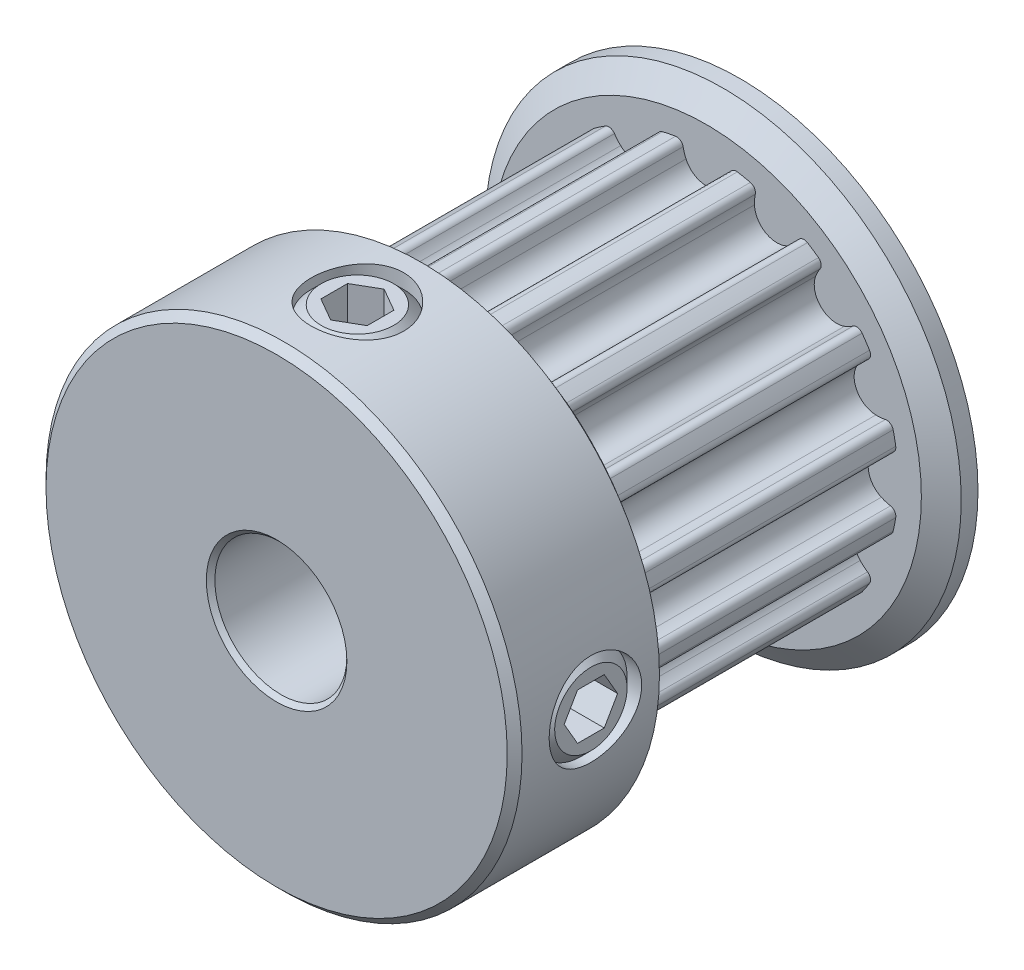
from build123d import *

# Parameters (mm, degrees)
CUT_EXTRUDE1_START = 2.655
CUT_EXTRUDE1_DEPTH = 10.16
CIRPATTERN1_COUNT  = 16
SKETCH4_R          = 1.7526
CUT_EXTRUDE2_DEPTH = 16.477114557
CUT_EXTRUDE3_DEPTH = 1.31445
CIRPATTERN3_COUNT  = 2
CIRPATTERN3_ANGLE  = 90
CHAMFER1_SIZE      = 0.28075
SKETCH7_R          = 2.5
CUT_EXTRUDE4_DEPTH = 22.692002065


with BuildPart() as part:
    # Sketch2 → Revolve1 (revolve)
    with BuildSketch(Plane(origin=(0, 0, 0), x_dir=(0, 0, -1), z_dir=(1, 0, 0)), mode=Mode.PRIVATE) as revolve1_sk:
        Polygon((-8.775, 2.38125), (8.775, 2.38125), (8.775, 9.015), (8.14, 9.015), (7.505, 8.13975), (7.505, 7.2645), (-2.655, 7.2645), (-2.655, 8.13975), (-3.29, 9.015), (-8.775, 9.015), align=None)
    revolve(revolve1_sk.sketch.rotate(Axis((0, 0, 8.775), (0, 0, -1)), 90), axis=Axis((0, 0, 8.775), (0, 0, -1)))

    # Sketch3 → Cut-Extrude1 (cut)
    with BuildSketch(Plane.XY.offset(CUT_EXTRUDE1_START)):
        with BuildLine():
            Line((3.757926927, 9.015), (-3.757926927, 9.015))
            Line((-3.757926927, 9.015), (-2.795101196, 6.705249403))
            ThreePointArc((-2.795101196, 6.705249403), (-1.995846132, 6.984952288), (-1.169472895, 7.169748489))
            ThreePointArc((-1.169472895, 7.169748489), (-0.985767742, 7.127751824), (-0.883573242, 6.969424355))
            ThreePointArc((-0.883573242, 6.969424355), (-0.839120956, 6.792881518), (-0.773880597, 6.622919538))
            ThreePointArc((-0.773880597, 6.622919538), (0, 6.1245), (0.773880597, 6.622919538))
            ThreePointArc((0.773880597, 6.622919538), (0.839120956, 6.792881518), (0.883573242, 6.969424355))
            ThreePointArc((0.883573242, 6.969424355), (0.985767742, 7.127751824), (1.169472895, 7.169748489))
            ThreePointArc((1.169472895, 7.169748489), (1.995846132, 6.984952288), (2.795101196, 6.705249403))
            Line((2.795101196, 6.705249403), (3.757926927, 9.015))
        make_face()
    cut_extrude1 = extrude(amount=-CUT_EXTRUDE1_DEPTH, mode=Mode.SUBTRACT)

    # CirPattern1: Cut-Extrude1 ×16 about axis
    cirpattern1_axis = Axis((0, 0, 0), (0, 0, 1))
    for i in range(1, CIRPATTERN1_COUNT):
        add(cut_extrude1.rotate(cirpattern1_axis, i * 360 / CIRPATTERN1_COUNT), mode=Mode.SUBTRACT)

    # Sketch4 → Cut-Extrude2 (cut, through all)
    with BuildSketch(Plane(origin=(0, 0, 0), x_dir=(0, -1, 0), z_dir=(1, 0, 0))):
        with Locations(Location((0, -5.715, 0), (0, 0, 270))):
            Circle(SKETCH4_R)
    cut_extrude2 = extrude(amount=CUT_EXTRUDE2_DEPTH, mode=Mode.SUBTRACT)

    # Sketch5 → Revolve2 (revolve)
    with BuildSketch(Plane.XY.offset(5.715), mode=Mode.PRIVATE) as revolve2_sk:
        Polygon((2.38125, -1.3716), (2.38125, 0), (8.842998261, 0), (8.842998261, -1.3716), (8.461998261, -1.7526), (2.76225, -1.7526), align=None)
    revolve2 = revolve(revolve2_sk.sketch.rotate(Axis((2.38125, 0, 5.715), (1, 0, 0)), 270), axis=Axis((2.38125, 0, 5.715), (1, 0, 0)))

    # Sketch6 → Cut-Extrude3 (cut)
    with BuildSketch(Plane(origin=(8.842998261, 5.384140679, 0), x_dir=(0, -1, 0), z_dir=(-1, 0, 0))):
        Polygon((5.384140679, 6.726864082), (4.507840679, 6.220932041), (4.507840679, 5.209067959), (5.384140679, 4.703135918), (6.260440679, 5.209067959), (6.260440679, 6.220932041), align=None)
    cut_extrude3 = extrude(amount=CUT_EXTRUDE3_DEPTH, mode=Mode.SUBTRACT)

    # CirPattern3: Cut-Extrude2, Revolve2, Cut-Extrude3 ×2 about axis
    cirpattern3_axis = Axis((0, 0, 0), (0, 0, 1))
    add([cut_extrude2.rotate(cirpattern3_axis, i * CIRPATTERN3_ANGLE / (CIRPATTERN3_COUNT - 1)) for i in range(1, CIRPATTERN3_COUNT)], mode=Mode.SUBTRACT)
    add([revolve2.rotate(cirpattern3_axis, i * CIRPATTERN3_ANGLE / (CIRPATTERN3_COUNT - 1)) for i in range(1, CIRPATTERN3_COUNT)])
    add([cut_extrude3.rotate(cirpattern3_axis, i * CIRPATTERN3_ANGLE / (CIRPATTERN3_COUNT - 1)) for i in range(1, CIRPATTERN3_COUNT)], mode=Mode.SUBTRACT)

    # Chamfer1
    chamfer1_edges = [part.edges().sort_by_distance(p)[0] for p in [
        (-2.38125, 0, 8.775),
        (-9.015, 0, 8.775),
    ]]
    chamfer(chamfer1_edges, length=CHAMFER1_SIZE)

    # Sketch7 → Cut-Extrude4 (cut, through all)
    with BuildSketch(Plane(origin=(0, 0, -8.775), x_dir=(-1, 0, 0), z_dir=(0, 0, -1))):
        Circle(SKETCH7_R)
    extrude(amount=-CUT_EXTRUDE4_DEPTH, mode=Mode.SUBTRACT)


solid = part.part
